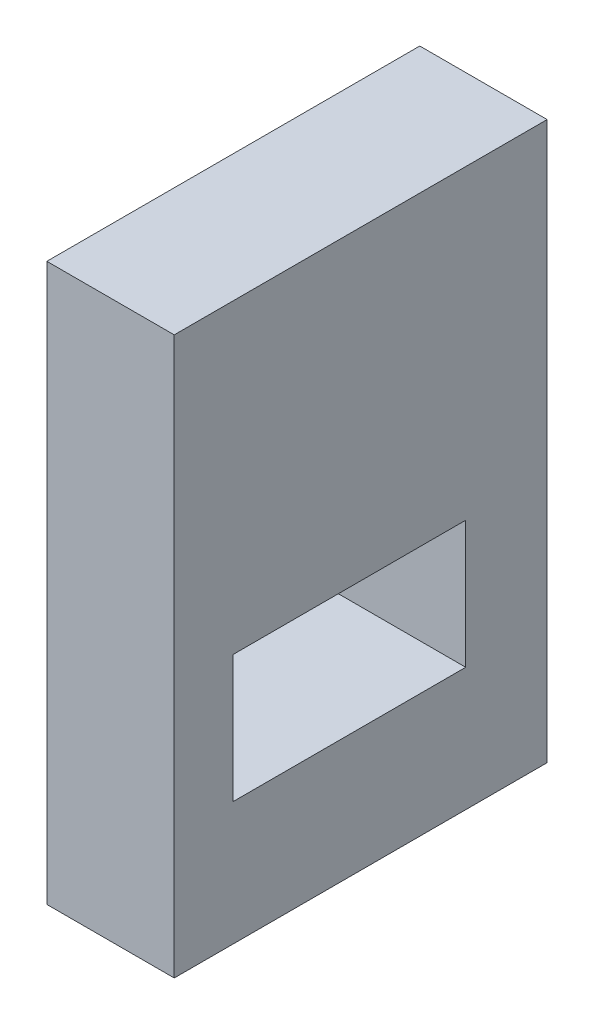
from build123d import *

# Parameters (mm, degrees)
SKETCH2_W           = 146.376941915
SKETCH2_H           = 218.632716635
BOSS_EXTRUDE2_DEPTH = 25
CUT_EXTRUDE1_DEPTH  = 50


with BuildPart() as part:
    # Sketch2 → Boss-Extrude2 (new, symmetric)
    with BuildSketch(Plane(origin=(0, 0, 0), x_dir=(0, 0, -1), z_dir=(1, 0, 0))):
        with Locations((-3.490539111, 10.898614686)):
            Rectangle(SKETCH2_W, SKETCH2_H)
    extrude(amount=BOSS_EXTRUDE2_DEPTH, both=True)

    # Sketch1 → Cut-Extrude1 (cut)
    with BuildSketch(Plane(origin=(0, 0, 0), x_dir=(1, 0, 0), z_dir=(0, 1, 0))):
        with BuildLine():
            Line((28.234849526, 37.73567567), (-25.290931566, 37.73567567))
            add(Edge.make_bspline(
                [(-25.290931566, 37.73567567), (-30.76189097, 7.536622835), (-30.130821337, -23.0684525), (-31.981654202, -53.525781092)],
                knots=[0, 0, 0, 0, 1, 1, 1, 1], degree=3))
            Line((-31.981654202, -53.525781092), (35.996087784, -53.525781092))
            add(Edge.make_bspline(
                [(28.234849526, 37.73567567), (39.487990314, 7.96851172), (30.114114901, -23.184955899), (35.996087784, -53.525781092)],
                knots=[0, 0, 0, 0, 1, 1, 1, 1], degree=3))
        make_face()
    extrude(amount=-CUT_EXTRUDE1_DEPTH, mode=Mode.SUBTRACT)


solid = part.part
